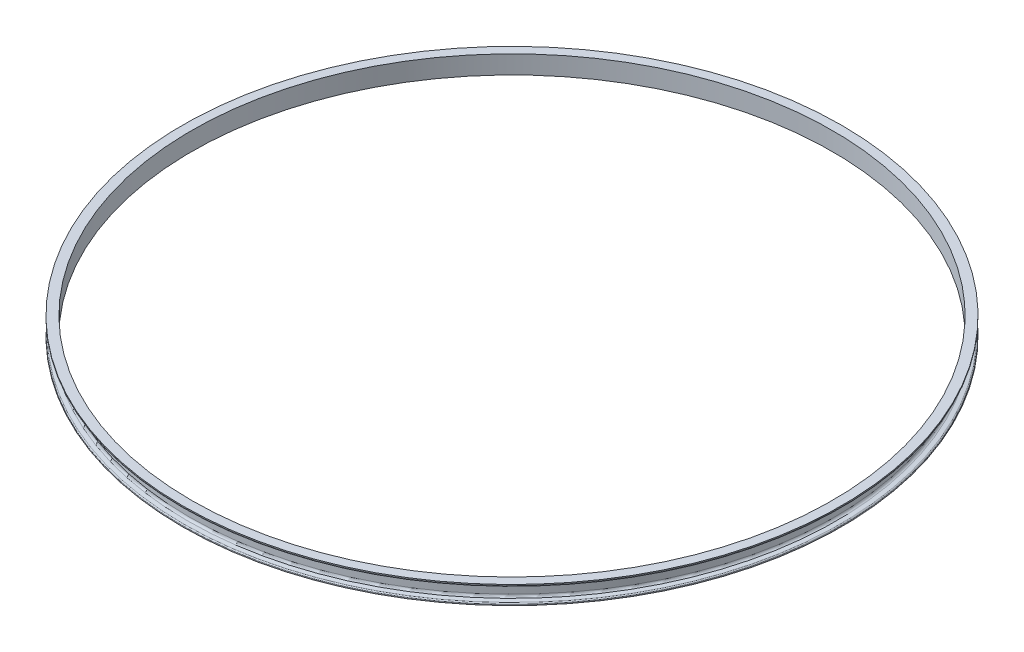
from build123d import *


with BuildPart() as part:
    # Sketch1 → Revolve1 (revolve)
    with BuildSketch(Plane.XY, mode=Mode.PRIVATE) as revolve1_sk:
        with BuildLine():
            Line((0, 0), (0, 40))
            Line((0, 40), (20, 40))
            Line((20, 40), (20, 37.86788351))
            ThreePointArc((20, 37.86788351), (19.407559514, 36.251957552), (17.91102664, 35.401903562))
            Line((17.91102664, 35.401903562), (9.17794672, 33.946284063))
            ThreePointArc((9.17794672, 33.946284063), (6.184880972, 32.246176083), (5, 29.014324168))
            Line((5, 29.014324168), (5, 10.985675832))
            ThreePointArc((5, 10.985675832), (6.184880972, 7.753823917), (9.17794672, 6.053715937))
            Line((9.17794672, 6.053715937), (17.91102664, 4.598096438))
            ThreePointArc((17.91102664, 4.598096438), (19.407559514, 3.748042448), (20, 2.13211649))
            Line((20, 2.13211649), (20, 0))
            Line((20, 0), (0, 0))
        make_face()
    revolve(revolve1_sk.sketch.rotate(Axis((-700, 40, 0), (0, -1, 0)), 90), axis=Axis((-700, 40, 0), (0, -1, 0)))


solid = part.part
